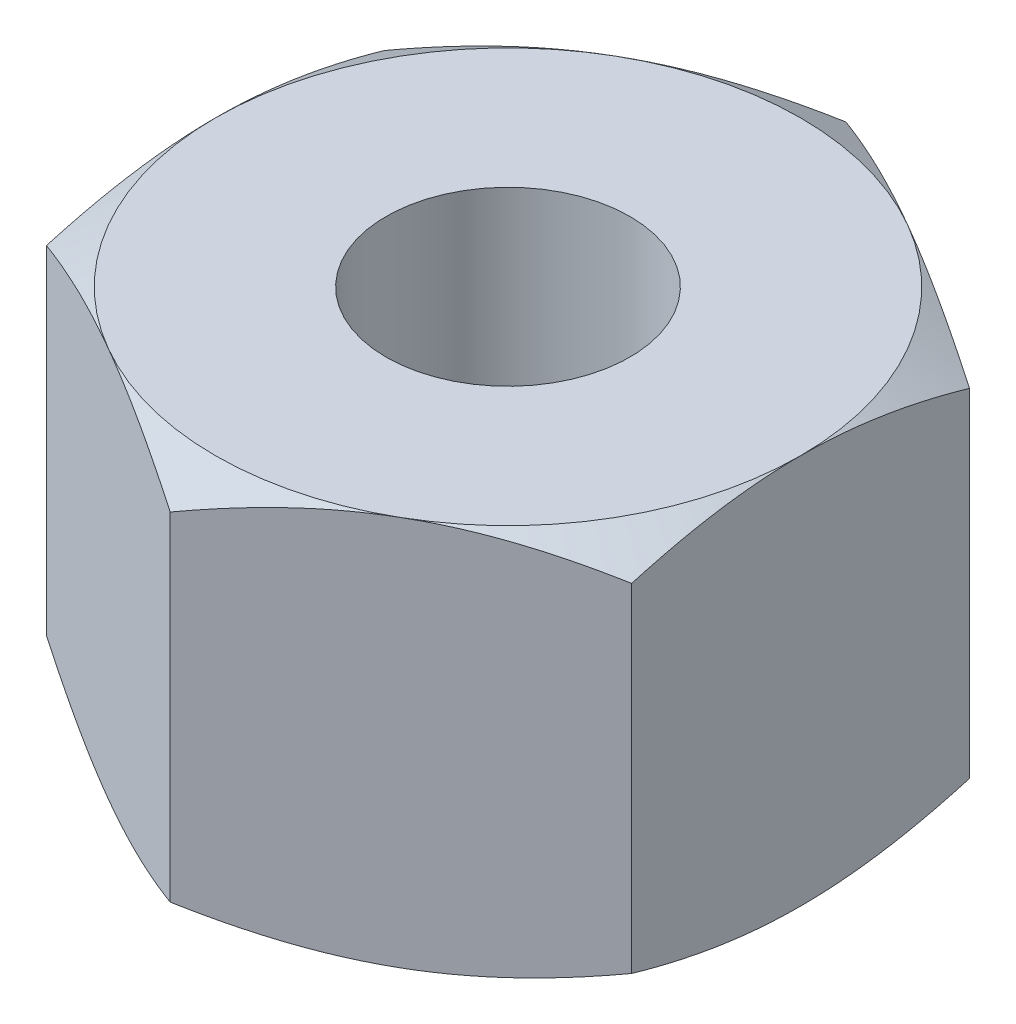
from build123d import *

# Parameters (mm, degrees)
SKETCH1_R           = 0.625
BOSS_EXTRUDE1_DEPTH = 2
SKETCH2_OUTSIDE_W   = 12.928
SKETCH2_OUTSIDE_H   = 13.392
SKETCH2_OUTSIDE_R   = 1.5
CUT_EXTRUDE1_DEPTH  = 2
CUT_EXTRUDE1_DRAFT  = -60
SKETCH3_OUTSIDE_W   = 12.928
SKETCH3_OUTSIDE_H   = 13.392
SKETCH3_OUTSIDE_R   = 1.5
CUT_EXTRUDE2_DEPTH  = 2
CUT_EXTRUDE2_DRAFT  = -60


with BuildPart() as part:
    # Sketch1 → Boss-Extrude1 (new body)
    with BuildSketch(Plane(origin=(0, 0, 0), x_dir=(1, 0, 0), z_dir=(0, 1, 0))):
        Polygon((0, 1.732050808), (-1.5, 0.866025404), (-1.5, -0.866025404), (0, -1.732050808), (1.5, -0.866025404), (1.5, 0.866025404), align=None)
        with Locations(Location((0, 0, 0), (0, 0, 270))):
            Circle(SKETCH1_R, mode=Mode.SUBTRACT)
    extrude(amount=BOSS_EXTRUDE1_DEPTH)


with BuildPart() as cut_extrude1_tool:
    # Sketch2 outside → Cut-Extrude1 (with draft: the straight prism first)
    with BuildSketch(Plane(origin=(0, 2, 0), x_dir=(1, 0, 0), z_dir=(0, 1, 0))):
        Rectangle(SKETCH2_OUTSIDE_W, SKETCH2_OUTSIDE_H)
        Circle(SKETCH2_OUTSIDE_R, mode=Mode.SUBTRACT)
    extrude(amount=-CUT_EXTRUDE1_DEPTH)
    # Cut-Extrude1: the draft: its side faces are tilted about the plane it starts from
    cut_extrude1_sides = [cut_extrude1_tool.faces().sort_by_distance(p)[0] for p in [
        (0, 1, 6.696),
        (6.464, 1, 0),
        (0, 1, -6.696),
        (-6.464, 1, 0),
        (-1.5, 1, 0),
    ]]
    draft(cut_extrude1_sides, Plane(origin=(0, 2, 0), x_dir=(1, 0, 0), z_dir=(0, 1, 0)), CUT_EXTRUDE1_DRAFT)


with BuildPart() as part_1:
    add(part.part)

    # Cut-Extrude1: cut by cut_extrude1_tool
    add(cut_extrude1_tool.part, mode=Mode.SUBTRACT)


with BuildPart() as cut_extrude2_tool:
    # Sketch3 outside → Cut-Extrude2 (with draft: the straight prism first)
    with BuildSketch(Plane.XZ):
        Rectangle(SKETCH3_OUTSIDE_W, SKETCH3_OUTSIDE_H)
        Circle(SKETCH3_OUTSIDE_R, mode=Mode.SUBTRACT)
    extrude(amount=-CUT_EXTRUDE2_DEPTH)
    # Cut-Extrude2: the draft: its side faces are tilted about the plane it starts from
    cut_extrude2_sides = [cut_extrude2_tool.faces().sort_by_distance(p)[0] for p in [
        (0, 1, -6.696),
        (6.464, 1, 0),
        (0, 1, 6.696),
        (-6.464, 1, 0),
        (-1.5, 1, 0),
    ]]
    draft(cut_extrude2_sides, Plane.XZ, CUT_EXTRUDE2_DRAFT)


with BuildPart() as part_2:
    add(part_1.part)

    # Cut-Extrude2: cut by cut_extrude2_tool
    add(cut_extrude2_tool.part, mode=Mode.SUBTRACT)


solid = part_2.part
